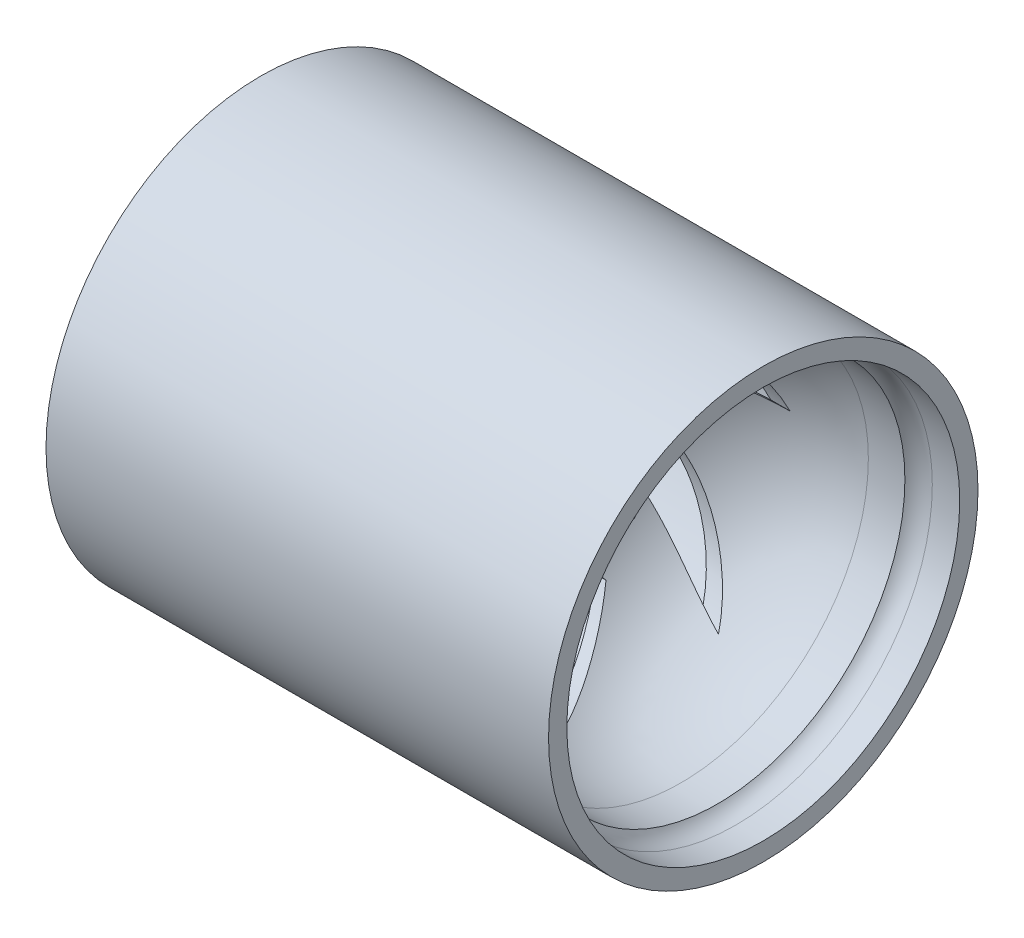
from build123d import *

# Parameters (mm, degrees)
SKETCH1_W                      = 42
SKETCH1_H                      = 7.375
SKETCH3_R                      = 2
CUT_EXTRUDE1_DEPTH             = 71.345575554
CUT_EXTRUDE5_DEPTH             = 160
CIRPATTERN1_COUNT              = 6
SKETCH7_R                      = 0.75
BOSS_EXTRUDE1_DEPTH            = 42
DOME1_FACE_RADIUS              = 0.75
DOME1_HEIGHT                   = 0.75
CIRPATTERN2_COUNT              = 9
CIRPATTERN2_COPY_1_FACE_RADIUS = 0.75
CIRPATTERN2_COPY_1_HEIGHT      = 0.75
CIRPATTERN2_COPY_2_FACE_RADIUS = 0.75
CIRPATTERN2_COPY_2_HEIGHT      = 0.75
CIRPATTERN2_COPY_3_FACE_RADIUS = 0.75
CIRPATTERN2_COPY_3_HEIGHT      = 0.75
CIRPATTERN2_COPY_4_FACE_RADIUS = 0.75
CIRPATTERN2_COPY_4_HEIGHT      = 0.75
CIRPATTERN2_COPY_5_FACE_RADIUS = 0.75
CIRPATTERN2_COPY_5_HEIGHT      = 0.75
CIRPATTERN2_COPY_6_FACE_RADIUS = 0.75
CIRPATTERN2_COPY_6_HEIGHT      = 0.75
CIRPATTERN2_COPY_7_FACE_RADIUS = 0.75
CIRPATTERN2_COPY_7_HEIGHT      = 0.75
CIRPATTERN2_COPY_8_FACE_RADIUS = 0.75
CIRPATTERN2_COPY_8_HEIGHT      = 0.75


with BuildPart() as part:
    # Sketch1 → Revolve1 (revolve)
    with BuildSketch(Plane.XY, mode=Mode.PRIVATE) as revolve1_sk:
        with Locations((21, 3.6875)):
            Rectangle(SKETCH1_W, SKETCH1_H)
    revolve(revolve1_sk.sketch.rotate(Axis((0, 0, 0), (1, 0, 0)), 90), axis=Axis((0, 0, 0), (1, 0, 0)))

    # Sketch2 → Revolve2 (revolve)
    with BuildSketch(Plane.XY, mode=Mode.PRIVATE) as revolve2_sk:
        with BuildLine():
            Line((62, 21.5), (62, 23.5))
            Line((62, 23.5), (7, 23.5))
            Line((7, 23.5), (7, 7.375))
            Line((7, 7.375), (37, 7.375))
            ThreePointArc((37, 7.375), (42.652710198, 16.798958045), (53, 20.5))
            Line((53, 20.5), (57, 20.5))
            ThreePointArc((57, 20.5), (57.881966011, 21.236067977), (59, 21.5))
            Line((59, 21.5), (62, 21.5))
        make_face()
    revolve(revolve2_sk.sketch.rotate(Axis((0, 0, 0), (1, 0, 0)), 90), axis=Axis((0, 0, 0), (1, 0, 0)))

    # Sketch3 → Cut-Extrude1 (cut, through all)
    with BuildSketch(Plane.ZY):
        Circle(SKETCH3_R)
    extrude(amount=-CUT_EXTRUDE1_DEPTH, mode=Mode.SUBTRACT)

    # Sketch4 → Cut-Revolve1 (revolve, cut)
    with BuildSketch(Plane.XY, mode=Mode.PRIVATE) as cut_revolve1_sk:
        with BuildLine():
            Line((7, 7.375), (36.199702384, 7.375))
            Line((36.199702384, 7.375), (36.199702384, 8.375))
            ThreePointArc((36.199702384, 8.375), (42.34031397, 17.82975888), (53, 21.5))
            Line((53, 21.5), (56.550510257, 21.5))
            ThreePointArc((56.550510257, 21.5), (57.677124344, 22.240370349), (59, 22.5))
            Line((59, 22.5), (8, 22.5))
            Line((8, 22.5), (7, 22.5))
            Line((7, 22.5), (7, 7.375))
        make_face()
    revolve(cut_revolve1_sk.sketch.rotate(Axis((0, 0, 0), (1, 0, 0)), 90), axis=Axis((0, 0, 0), (1, 0, 0)), mode=Mode.SUBTRACT)

    # Sketch5 → Cut-Extrude5 (cut)
    with BuildSketch(Plane(origin=(0, 0, 0), x_dir=(0, 0, -1), z_dir=(1, 0, 0))):
        with BuildLine():
            Line((-1.064775316, 11.171868119), (0, 8.603276353))
            ThreePointArc((0, 8.603276353), (-3.273813548, 9.021501038), (-5.777548449, 11.171868119))
            ThreePointArc((-5.777548449, 11.171868119), (-0.00664509, 16.522600129), (7.828462332, 17.260672155))
            ThreePointArc((7.828462332, 17.260672155), (2.907428719, 14.909194959), (-1.064775316, 11.171868119))
        make_face()
    cut_extrude5 = extrude(amount=CUT_EXTRUDE5_DEPTH, mode=Mode.SUBTRACT)

    # CirPattern1: Cut-Extrude5 ×6 about axis
    cirpattern1_axis = Axis((0, 0, 0), (1, 0, 0))
    for i in range(1, CIRPATTERN1_COUNT):
        add(cut_extrude5.rotate(cirpattern1_axis, i * 360 / CIRPATTERN1_COUNT), mode=Mode.SUBTRACT)

    # Sketch6 → Cut-Revolve2 (revolve, cut)
    with BuildSketch(Plane.XY, mode=Mode.PRIVATE) as cut_revolve2_sk:
        with BuildLine():
            Line((39, 7.375), (39, 9.30874138))
            Line((39, 9.30874138), (44.447599475, 9.30874138))
            Line((44.447599475, 9.30874138), (44.447599475, 4.375))
            Line((44.447599475, 4.375), (42, 4.375))
            ThreePointArc((42, 4.375), (41.121320344, 6.496320344), (39, 7.375))
        make_face()
    revolve(cut_revolve2_sk.sketch.rotate(Axis((0, 0, 0), (1, 0, 0)), 90), axis=Axis((0, 0, 0), (1, 0, 0)), mode=Mode.SUBTRACT)

    # Sketch7 → Boss-Extrude1 (add)
    with BuildSketch(Plane(origin=(0, 0, 0), x_dir=(0, 0, -1), z_dir=(1, 0, 0))):
        with Locations(Location((0, 5.8, 0), (0, 0, 67.957088204))):
            Circle(SKETCH7_R)
    boss_extrude1 = extrude(amount=BOSS_EXTRUDE1_DEPTH)

    # Dome1: a dome of height H over a round flat face of radius A is a cap of a sphere of radius (A * A + H * H) / (2 * H)
    dome1_r = (DOME1_FACE_RADIUS * DOME1_FACE_RADIUS + DOME1_HEIGHT * DOME1_HEIGHT) / (2 * DOME1_HEIGHT)
    dome1_base = Plane((42, 5.8, 0), z_dir=(1, 0, 0))
    with Locations(dome1_base.offset(DOME1_HEIGHT - dome1_r)):
        dome1_ball = Sphere(dome1_r, mode=Mode.PRIVATE)
    add(split(dome1_ball, bisect_by=dome1_base, keep=Keep.TOP, mode=Mode.PRIVATE))

    # CirPattern2: Boss-Extrude1 ×9 about axis
    cirpattern2_axis = Axis((0, 0, 0), (1, 0, 0))
    for i in range(1, CIRPATTERN2_COUNT):
        add(boss_extrude1.rotate(cirpattern2_axis, i * 360 / CIRPATTERN2_COUNT))

    # CirPattern2 copy 1: a dome of height H over a round flat face of radius A is a cap of a sphere of radius (A * A + H * H) / (2 * H)
    cirpattern2_copy_1_r = (CIRPATTERN2_COPY_1_FACE_RADIUS * CIRPATTERN2_COPY_1_FACE_RADIUS + CIRPATTERN2_COPY_1_HEIGHT * CIRPATTERN2_COPY_1_HEIGHT) / (2 * CIRPATTERN2_COPY_1_HEIGHT)
    cirpattern2_copy_1_base = Plane((42, 4.44305777, 3.728168136), z_dir=(1, 0, 0))
    with Locations(cirpattern2_copy_1_base.offset(CIRPATTERN2_COPY_1_HEIGHT - cirpattern2_copy_1_r)):
        cirpattern2_copy_1_ball = Sphere(cirpattern2_copy_1_r, mode=Mode.PRIVATE)
    add(split(cirpattern2_copy_1_ball, bisect_by=cirpattern2_copy_1_base, keep=Keep.TOP, mode=Mode.PRIVATE))

    # CirPattern2 copy 2: a dome of height H over a round flat face of radius A is a cap of a sphere of radius (A * A + H * H) / (2 * H)
    cirpattern2_copy_2_r = (CIRPATTERN2_COPY_2_FACE_RADIUS * CIRPATTERN2_COPY_2_FACE_RADIUS + CIRPATTERN2_COPY_2_HEIGHT * CIRPATTERN2_COPY_2_HEIGHT) / (2 * CIRPATTERN2_COPY_2_HEIGHT)
    cirpattern2_copy_2_base = Plane((42, 1.00715943, 5.711884967), z_dir=(1, 0, 0))
    with Locations(cirpattern2_copy_2_base.offset(CIRPATTERN2_COPY_2_HEIGHT - cirpattern2_copy_2_r)):
        cirpattern2_copy_2_ball = Sphere(cirpattern2_copy_2_r, mode=Mode.PRIVATE)
    add(split(cirpattern2_copy_2_ball, bisect_by=cirpattern2_copy_2_base, keep=Keep.TOP, mode=Mode.PRIVATE))

    # CirPattern2 copy 3: a dome of height H over a round flat face of radius A is a cap of a sphere of radius (A * A + H * H) / (2 * H)
    cirpattern2_copy_3_r = (CIRPATTERN2_COPY_3_FACE_RADIUS * CIRPATTERN2_COPY_3_FACE_RADIUS + CIRPATTERN2_COPY_3_HEIGHT * CIRPATTERN2_COPY_3_HEIGHT) / (2 * CIRPATTERN2_COPY_3_HEIGHT)
    cirpattern2_copy_3_base = Plane((42, -2.9, 5.022947342), z_dir=(1, 0, 0))
    with Locations(cirpattern2_copy_3_base.offset(CIRPATTERN2_COPY_3_HEIGHT - cirpattern2_copy_3_r)):
        cirpattern2_copy_3_ball = Sphere(cirpattern2_copy_3_r, mode=Mode.PRIVATE)
    add(split(cirpattern2_copy_3_ball, bisect_by=cirpattern2_copy_3_base, keep=Keep.TOP, mode=Mode.PRIVATE))

    # CirPattern2 copy 4: a dome of height H over a round flat face of radius A is a cap of a sphere of radius (A * A + H * H) / (2 * H)
    cirpattern2_copy_4_r = (CIRPATTERN2_COPY_4_FACE_RADIUS * CIRPATTERN2_COPY_4_FACE_RADIUS + CIRPATTERN2_COPY_4_HEIGHT * CIRPATTERN2_COPY_4_HEIGHT) / (2 * CIRPATTERN2_COPY_4_HEIGHT)
    cirpattern2_copy_4_base = Plane((42, -5.450217201, 1.983716831), z_dir=(1, 0, 0))
    with Locations(cirpattern2_copy_4_base.offset(CIRPATTERN2_COPY_4_HEIGHT - cirpattern2_copy_4_r)):
        cirpattern2_copy_4_ball = Sphere(cirpattern2_copy_4_r, mode=Mode.PRIVATE)
    add(split(cirpattern2_copy_4_ball, bisect_by=cirpattern2_copy_4_base, keep=Keep.TOP, mode=Mode.PRIVATE))

    # CirPattern2 copy 5: a dome of height H over a round flat face of radius A is a cap of a sphere of radius (A * A + H * H) / (2 * H)
    cirpattern2_copy_5_r = (CIRPATTERN2_COPY_5_FACE_RADIUS * CIRPATTERN2_COPY_5_FACE_RADIUS + CIRPATTERN2_COPY_5_HEIGHT * CIRPATTERN2_COPY_5_HEIGHT) / (2 * CIRPATTERN2_COPY_5_HEIGHT)
    cirpattern2_copy_5_base = Plane((42, -5.450217201, -1.983716831), z_dir=(1, 0, 0))
    with Locations(cirpattern2_copy_5_base.offset(CIRPATTERN2_COPY_5_HEIGHT - cirpattern2_copy_5_r)):
        cirpattern2_copy_5_ball = Sphere(cirpattern2_copy_5_r, mode=Mode.PRIVATE)
    add(split(cirpattern2_copy_5_ball, bisect_by=cirpattern2_copy_5_base, keep=Keep.TOP, mode=Mode.PRIVATE))

    # CirPattern2 copy 6: a dome of height H over a round flat face of radius A is a cap of a sphere of radius (A * A + H * H) / (2 * H)
    cirpattern2_copy_6_r = (CIRPATTERN2_COPY_6_FACE_RADIUS * CIRPATTERN2_COPY_6_FACE_RADIUS + CIRPATTERN2_COPY_6_HEIGHT * CIRPATTERN2_COPY_6_HEIGHT) / (2 * CIRPATTERN2_COPY_6_HEIGHT)
    cirpattern2_copy_6_base = Plane((42, -2.9, -5.022947342), z_dir=(1, 0, 0))
    with Locations(cirpattern2_copy_6_base.offset(CIRPATTERN2_COPY_6_HEIGHT - cirpattern2_copy_6_r)):
        cirpattern2_copy_6_ball = Sphere(cirpattern2_copy_6_r, mode=Mode.PRIVATE)
    add(split(cirpattern2_copy_6_ball, bisect_by=cirpattern2_copy_6_base, keep=Keep.TOP, mode=Mode.PRIVATE))

    # CirPattern2 copy 7: a dome of height H over a round flat face of radius A is a cap of a sphere of radius (A * A + H * H) / (2 * H)
    cirpattern2_copy_7_r = (CIRPATTERN2_COPY_7_FACE_RADIUS * CIRPATTERN2_COPY_7_FACE_RADIUS + CIRPATTERN2_COPY_7_HEIGHT * CIRPATTERN2_COPY_7_HEIGHT) / (2 * CIRPATTERN2_COPY_7_HEIGHT)
    cirpattern2_copy_7_base = Plane((42, 1.00715943, -5.711884967), z_dir=(1, 0, 0))
    with Locations(cirpattern2_copy_7_base.offset(CIRPATTERN2_COPY_7_HEIGHT - cirpattern2_copy_7_r)):
        cirpattern2_copy_7_ball = Sphere(cirpattern2_copy_7_r, mode=Mode.PRIVATE)
    add(split(cirpattern2_copy_7_ball, bisect_by=cirpattern2_copy_7_base, keep=Keep.TOP, mode=Mode.PRIVATE))

    # CirPattern2 copy 8: a dome of height H over a round flat face of radius A is a cap of a sphere of radius (A * A + H * H) / (2 * H)
    cirpattern2_copy_8_r = (CIRPATTERN2_COPY_8_FACE_RADIUS * CIRPATTERN2_COPY_8_FACE_RADIUS + CIRPATTERN2_COPY_8_HEIGHT * CIRPATTERN2_COPY_8_HEIGHT) / (2 * CIRPATTERN2_COPY_8_HEIGHT)
    cirpattern2_copy_8_base = Plane((42, 4.44305777, -3.728168136), z_dir=(1, 0, 0))
    with Locations(cirpattern2_copy_8_base.offset(CIRPATTERN2_COPY_8_HEIGHT - cirpattern2_copy_8_r)):
        cirpattern2_copy_8_ball = Sphere(cirpattern2_copy_8_r, mode=Mode.PRIVATE)
    add(split(cirpattern2_copy_8_ball, bisect_by=cirpattern2_copy_8_base, keep=Keep.TOP, mode=Mode.PRIVATE))


solid = part.part
